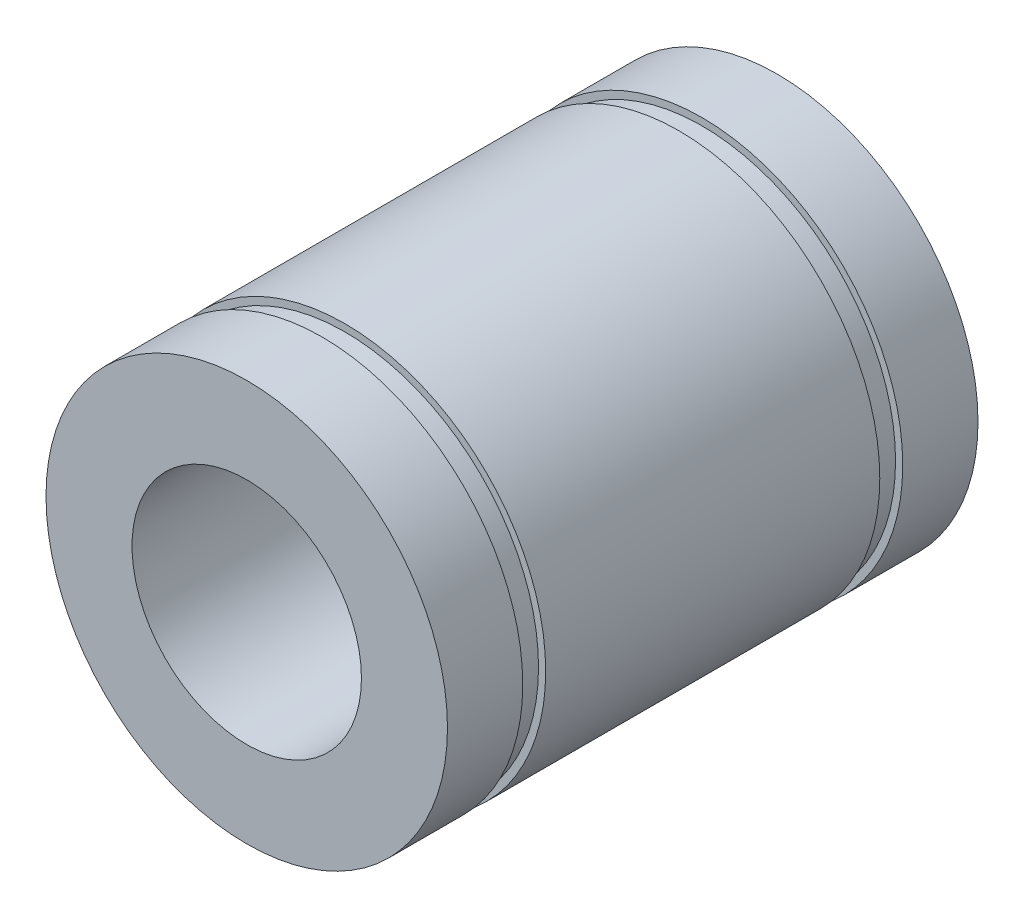
from build123d import *

# Parameters (mm, degrees)
SKETCH_1_R      = 14
SKETCH_1_R_2    = 8
EXTRUDE_1_DEPTH = 18.5
SKETCH_2_W      = 0.5
SKETCH_2_H      = 1.6


with BuildPart() as part:
    # 草图1 → 凸台-拉伸1 (new, symmetric)
    with BuildSketch(Plane.XY):
        Circle(SKETCH_1_R)
        Circle(SKETCH_1_R_2, mode=Mode.SUBTRACT)
    extrude(amount=EXTRUDE_1_DEPTH, both=True)

    # 草图2 → 切除-旋转1 (revolve, cut)
    with BuildSketch(Plane(origin=(0, 0, 0), x_dir=(1, 0, 0), z_dir=(0, 1, 0))):
        with Locations((13.75, 12.45)):
            Rectangle(SKETCH_2_W, SKETCH_2_H)
        with Locations((13.75, -12.45)):
            Rectangle(SKETCH_2_W, SKETCH_2_H)
    revolve(axis=Axis((0, 0, 18.5), (0, 0, -1)), mode=Mode.SUBTRACT)


solid = part.part
